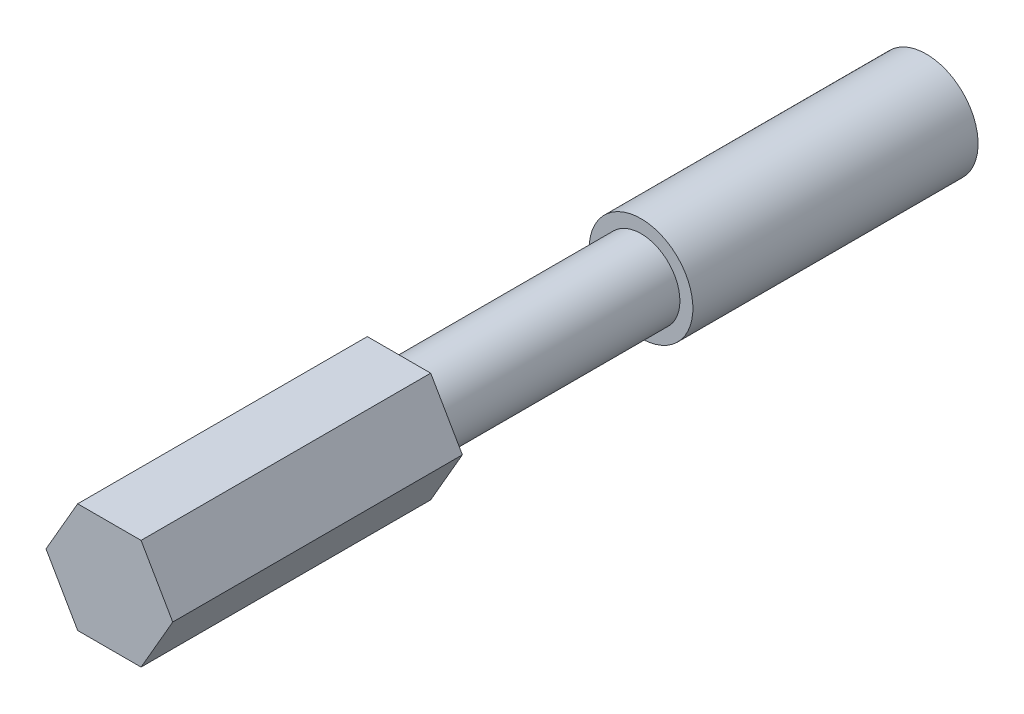
from build123d import *

# Parameters (mm, degrees)
BOSS_EXTRUDE1_DEPTH = 27
SKETCH2_R           = 4.5
BOSS_EXTRUDE2_DEPTH = 61
CUT_EXTRUDE1_DEPTH  = 14
SKETCH4_R           = 6
BOSS_EXTRUDE3_DEPTH = 33
BOSS_EXTRUDE4_DEPTH = 6.51


with BuildPart() as part:
    # Sketch1 → Boss-Extrude1 (new body)
    with BuildSketch(Plane.XY):
        Polygon((3.666174209, -6.35), (7.332348419, 0), (3.666174209, 6.35), (-3.666174209, 6.35), (-7.332348419, 0), (-3.666174209, -6.35), align=None)
    extrude(amount=BOSS_EXTRUDE1_DEPTH)

    # Sketch2 → Boss-Extrude2 (add)
    with BuildSketch(Plane(origin=(0, 0, 0), x_dir=(-1, 0, 0), z_dir=(0, 0, -1))):
        with Locations(Location((0, 0, 0), (0, 0, 180))):
            Circle(SKETCH2_R)
    extrude(amount=BOSS_EXTRUDE2_DEPTH)

    # Sketch3 → Cut-Extrude1 (cut)
    with BuildSketch(Plane(origin=(0, 0, -61), x_dir=(-1, 0, 0), z_dir=(0, 0, -1))):
        with BuildLine():
            Line((-2.645751311, 3), (2.645751311, 3))
            ThreePointArc((2.645751311, 3), (4, 0), (2.645751311, -3))
            Line((2.645751311, -3), (-2.645751311, -3))
            ThreePointArc((-2.645751311, -3), (-4, 0), (-2.645751311, 3))
        make_face()
    extrude(amount=-CUT_EXTRUDE1_DEPTH, mode=Mode.SUBTRACT)

    # Sketch4 → Boss-Extrude3 (add)
    with BuildSketch(Plane(origin=(0, 0, -61), x_dir=(-1, 0, 0), z_dir=(0, 0, -1))):
        Circle(SKETCH4_R)
        with BuildLine():
            Line((-2.645751311, -3), (2.645751311, -3))
            ThreePointArc((2.645751311, -3), (4, 0), (2.645751311, 3))
            Line((2.645751311, 3), (-2.645751311, 3))
            ThreePointArc((-2.645751311, 3), (-4, 0), (-2.645751311, -3))
        make_face(mode=Mode.SUBTRACT)
    extrude(amount=-BOSS_EXTRUDE3_DEPTH)

    # Sketch5 → Boss-Extrude4 (add)
    with BuildSketch(Plane.XY.offset(27)):
        Polygon((-3.666174209, 6.35), (-7.332348419, 0), (-3.666174209, -6.35), (3.666174209, -6.35), (7.332348419, 0), (3.666174209, 6.35), align=None)
    extrude(amount=BOSS_EXTRUDE4_DEPTH)


solid = part.part
